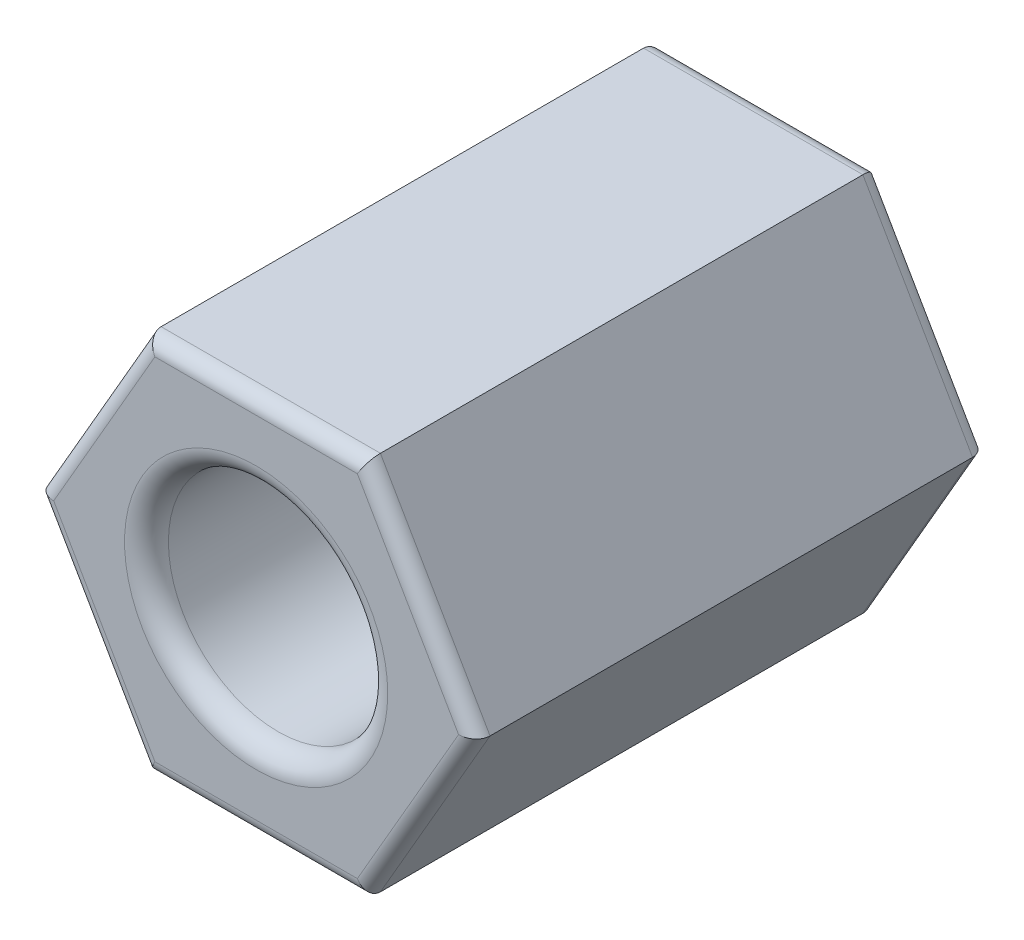
from build123d import *

# Parameters (mm, degrees)
SKETCH1_R           = 1.5
BOSS_EXTRUDE1_DEPTH = 7
FILLET1_R           = 0.3
FILLET2_R           = 0.2


with BuildPart() as part:
    # Sketch1 → Boss-Extrude1 (new body)
    with BuildSketch(Plane.XY):
        Polygon((3, 0), (1.5, 2.598076211), (-1.5, 2.598076211), (-3, 0), (-1.5, -2.598076211), (1.5, -2.598076211), align=None)
        Circle(SKETCH1_R, mode=Mode.SUBTRACT)
    extrude(amount=BOSS_EXTRUDE1_DEPTH)

    # Fillet1
    fillet1_edges = [part.edges().sort_by_distance(p)[0] for p in [
        (-1.5, 0, 0),
        (-1.5, 0, 7),
    ]]
    fillet(fillet1_edges, radius=FILLET1_R)

    # Fillet2
    fillet2_edges = [part.edges().sort_by_distance(p)[0] for p in [
        (-2.25, 1.299038106, 7),
        (-2.25, -1.299038106, 7),
        (0, -2.598076211, 7),
        (2.25, -1.299038106, 7),
        (2.25, 1.299038106, 7),
        (0, 2.598076211, 7),
        (2.25, -1.299038106, 0),
        (0, -2.598076211, 0),
        (-2.25, -1.299038106, 0),
        (-2.25, 1.299038106, 0),
        (0, 2.598076211, 0),
        (2.25, 1.299038106, 0),
    ]]
    fillet(fillet2_edges, radius=FILLET2_R)


solid = part.part
